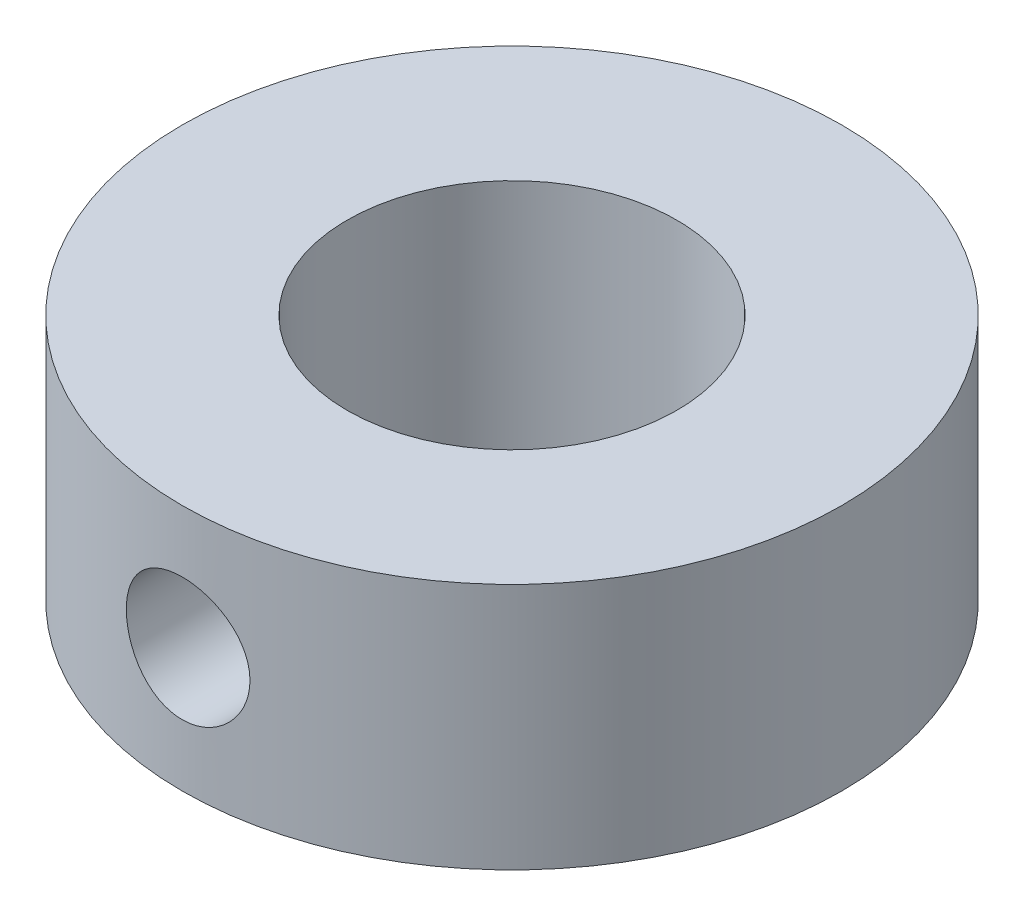
from build123d import *

# Parameters (mm, degrees)
SKETCH1_R           = 12.7
SKETCH1_R_2         = 6.35
BOSS_EXTRUDE1_DEPTH = 9.525
SKETCH2_R           = 2.38125
CUT_EXTRUDE1_DEPTH  = 21.329919454


with BuildPart() as part:
    # Sketch1 → Boss-Extrude1 (new body)
    with BuildSketch(Plane(origin=(0, 0, 0), x_dir=(1, 0, 0), z_dir=(0, 1, 0))):
        with Locations(Location((0, 0, 0), (0, 0, 90))):
            Circle(SKETCH1_R)
        with Locations(Location((0, 0, 0), (0, 0, 90))):
            Circle(SKETCH1_R_2, mode=Mode.SUBTRACT)
    extrude(amount=BOSS_EXTRUDE1_DEPTH)

    # Sketch2 → Cut-Extrude1 (cut, through all)
    with BuildSketch(Plane.XY):
        with Locations(Location((0, 4.7625, 0), (0, 0, 270.000000003))):
            Circle(SKETCH2_R)
    extrude(amount=CUT_EXTRUDE1_DEPTH, mode=Mode.SUBTRACT)


solid = part.part
